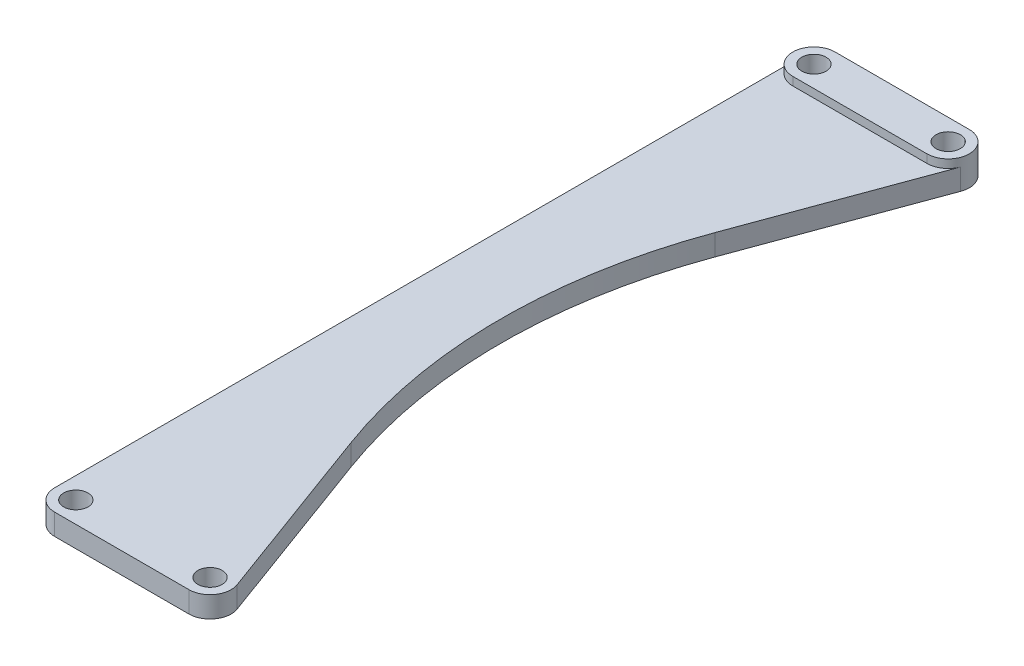
from build123d import *

# Parameters (mm, degrees)
SKETCH1_R           = 2.3
BOSS_EXTRUDE2_DEPTH = 4
FILLET1_R           = 4
FILLET2_R           = 100
SKETCH2_R           = 2.3
BOSS_EXTRUDE3_DEPTH = 1.575308


with BuildPart() as part:
    # Sketch1 → Boss-Extrude2 (new body)
    with BuildSketch(Plane(origin=(0, 0, 0), x_dir=(1, 0, 0), z_dir=(0, 1, 0))):
        with BuildLine():
            Line((-4, -143.7), (-4, 4))
            Line((-4, 4), (25.4, 4))
            ThreePointArc((25.4, 4), (28.6800532, 2.289377864), (29.154640594, -1.379374498))
            Line((29.154640594, -1.379374498), (4, -69.85))
            Line((4, -69.85), (29.154640594, -138.320625502))
            ThreePointArc((29.154640594, -138.320625502), (28.6800532, -141.989377864), (25.4, -143.7))
            Line((25.4, -143.7), (-4, -143.7))
        make_face()
        with Locations(Location((0, 0, 0), (0, 0, 270))):
            Circle(SKETCH1_R, mode=Mode.SUBTRACT)
        with Locations(Location((25.4, 0, 0), (0, 0, 270))):
            Circle(SKETCH1_R, mode=Mode.SUBTRACT)
        with Locations(Location((25.4, -139.7, 0), (0, 0, 270))):
            Circle(SKETCH1_R, mode=Mode.SUBTRACT)
        with Locations(Location((0, -139.7, 0), (0, 0, 270))):
            Circle(SKETCH1_R, mode=Mode.SUBTRACT)
    extrude(amount=BOSS_EXTRUDE2_DEPTH)

    # Fillet1
    fillet1_edges = [part.edges().sort_by_distance(p)[0] for p in [
        (-4, 2, 143.7),
        (-4, 2, -4),
    ]]
    fillet(fillet1_edges, radius=FILLET1_R)

    # Fillet2
    fillet2_edges = [part.edges().sort_by_distance(p)[0] for p in [
        (4, 2, 69.85),
    ]]
    fillet(fillet2_edges, radius=FILLET2_R)

    # Sketch2 → Boss-Extrude3 (add)
    with BuildSketch(Plane(origin=(0, 4, 0), x_dir=(1, 0, 0), z_dir=(0, 1, 0))):
        with BuildLine():
            Line((0, -4), (25.4, -4))
            ThreePointArc((25.4, -4), (29.4, 0), (25.4, 4))
            Line((25.4, 4), (0, 4))
            ThreePointArc((0, 4), (-4, 0), (0, -4))
        make_face()
        with Locations(Location((0, 0, 0), (0, 0, 270))):
            Circle(SKETCH2_R, mode=Mode.SUBTRACT)
        with Locations(Location((25.4, 0, 0), (0, 0, 270))):
            Circle(SKETCH2_R, mode=Mode.SUBTRACT)
    extrude(amount=BOSS_EXTRUDE3_DEPTH)


solid = part.part
